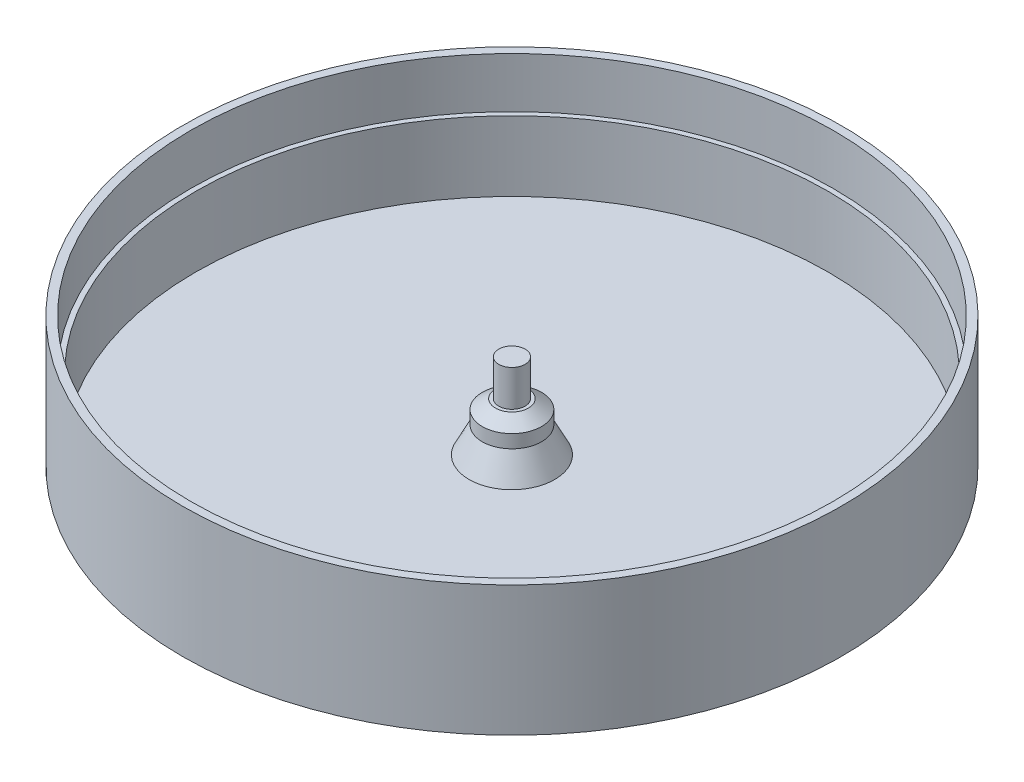
from build123d import *

# Parameters (mm, degrees)
SKETCH1_R           = 96
BOSS_EXTRUDE1_DEPTH = 3
SKETCH1_4_R         = 97.5
SKETCH1_4_R_2       = 96
BOSS_EXTRUDE2_DEPTH = 24.22
SKETCH1_5_R         = 100
SKETCH1_5_R_2       = 97.5
BOSS_EXTRUDE3_DEPTH = 39.5


with BuildPart() as part:
    # Sketch1 → Boss-Extrude1 (new body)
    with BuildSketch(Plane(origin=(0, 0, 0), x_dir=(1, 0, 0), z_dir=(0, 1, 0))):
        Circle(SKETCH1_R)
    extrude(amount=BOSS_EXTRUDE1_DEPTH)

    # Sketch1<4> → Boss-Extrude2 (add)
    with BuildSketch(Plane(origin=(0, 0, 0), x_dir=(1, 0, 0), z_dir=(0, 1, 0))):
        Circle(SKETCH1_4_R)
        Circle(SKETCH1_4_R_2, mode=Mode.SUBTRACT)
    extrude(amount=BOSS_EXTRUDE2_DEPTH)

    # Sketch1<5> → Boss-Extrude3 (add)
    with BuildSketch(Plane(origin=(0, 0, 0), x_dir=(1, 0, 0), z_dir=(0, 1, 0))):
        Circle(SKETCH1_5_R)
        Circle(SKETCH1_5_R_2, mode=Mode.SUBTRACT)
    extrude(amount=BOSS_EXTRUDE3_DEPTH)

    # Sketch6 → Revolve1 (revolve)
    with BuildSketch(Plane(origin=(0, 3, 0), x_dir=(1, 0, 0), z_dir=(0, 0, 1))):
        Polygon((0, 0), (-13, 0), (-9, 7.918840006), (-9, 11.918840006), (-5, 14.768523744), (-4, 14.768523744), (-4, 25.768523744), (0, 25.768523744), align=None)
    revolve(axis=Axis((0, 32.411214842, 0), (0, -1, 0)))


solid = part.part
